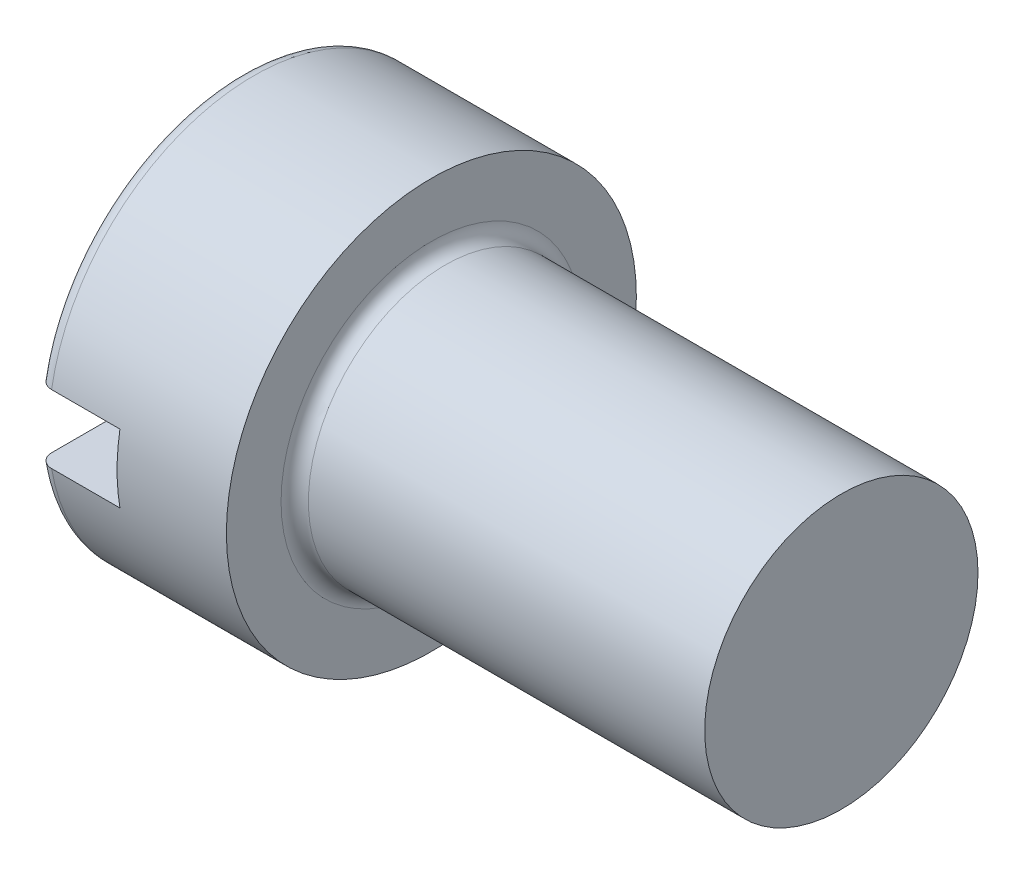
from build123d import *

# Parameters (mm, degrees)
SKETCH2_R           = 1.9
BASEHEAD_DEPTH      = 1.4
BASEHEAD_DRAFT      = -3
SKETCH3_R           = 1
BASEBODY_DEPTH      = 3
SLOT_DEPTH          = 8.598684097
SLOT_DEPTH_BACK     = 8.598684097
SKETCH4_W           = 0.5
SKETCH4_H           = 0.6
HEADFILLET_R        = 0.1
SKETCH_1_OUTSIDE_W  = 7.19
SKETCH_1_OUTSIDE_H  = 7.19
SKETCH_1_OUTSIDE_R  = 1.5
CUT_EXTRUDE_1_DEPTH = 6.155579502
FILLET_1_R          = 0.1


with BuildPart() as part:
    # Sketch2 → BaseHead (with draft: the straight prism first)
    with BuildSketch(Plane(origin=(1.4, 0, 0), x_dir=(0, 0, -1), z_dir=(1, 0, 0))):
        Circle(SKETCH2_R)
    extrude(amount=-BASEHEAD_DEPTH)
    # BaseHead: the draft: its side faces are tilted about the plane it starts from
    basehead_sides = [part.faces().sort_by_distance(p)[0] for p in [
        (0.7, 0, 1.9),
    ]]
    draft(basehead_sides, Plane(origin=(1.4, 0, 0), x_dir=(0, 0, -1), z_dir=(1, 0, 0)), BASEHEAD_DRAFT)

    # Sketch3 → BaseBody (add)
    with BuildSketch(Plane(origin=(1.4, -1.110095321, -1.354392991), x_dir=(0, 0, -1), z_dir=(1, 0, 0))):
        with Locations((-1.354392991, 1.110095321)):
            Circle(SKETCH3_R)
    extrude(amount=BASEBODY_DEPTH)

    # Sketch4 → Slot (cut, two sides: drawn at the far end of the back side and taken through both)
    with BuildSketch(Plane(origin=(-1.9, -1.9, 0), x_dir=(0, 1, 0), z_dir=(0, 0, 1)).offset(-SLOT_DEPTH_BACK)):
        with Locations((1.9, -2.2)):
            Rectangle(SKETCH4_W, SKETCH4_H)
    extrude(amount=SLOT_DEPTH + SLOT_DEPTH_BACK, mode=Mode.SUBTRACT)

    # HeadFillet
    headfillet_edges = [part.edges().sort_by_distance(p)[0] for p in [
        (1.4, 0, 1),
        (0, -1.826629109, 0),
        (0, 1.826629109, 0),
    ]]
    fillet(headfillet_edges, radius=HEADFILLET_R)

    # 草图1 outside → 切除-拉伸1 (cut, through all)
    with BuildSketch(Plane.ZY):
        Rectangle(SKETCH_1_OUTSIDE_W, SKETCH_1_OUTSIDE_H)
        with Locations(Location((0, 0, 0), (0, 0, 350.405931773))):
            Circle(SKETCH_1_OUTSIDE_R, mode=Mode.SUBTRACT)
    extrude(amount=-CUT_EXTRUDE_1_DEPTH, mode=Mode.SUBTRACT)

    # 圆角1
    fillet_1_edges = [part.edges().sort_by_distance(p)[0] for p in [
        (0, 1.5, 0),
        (0, -1.5, 0),
    ]]
    fillet(fillet_1_edges, radius=FILLET_1_R)


solid = part.part
